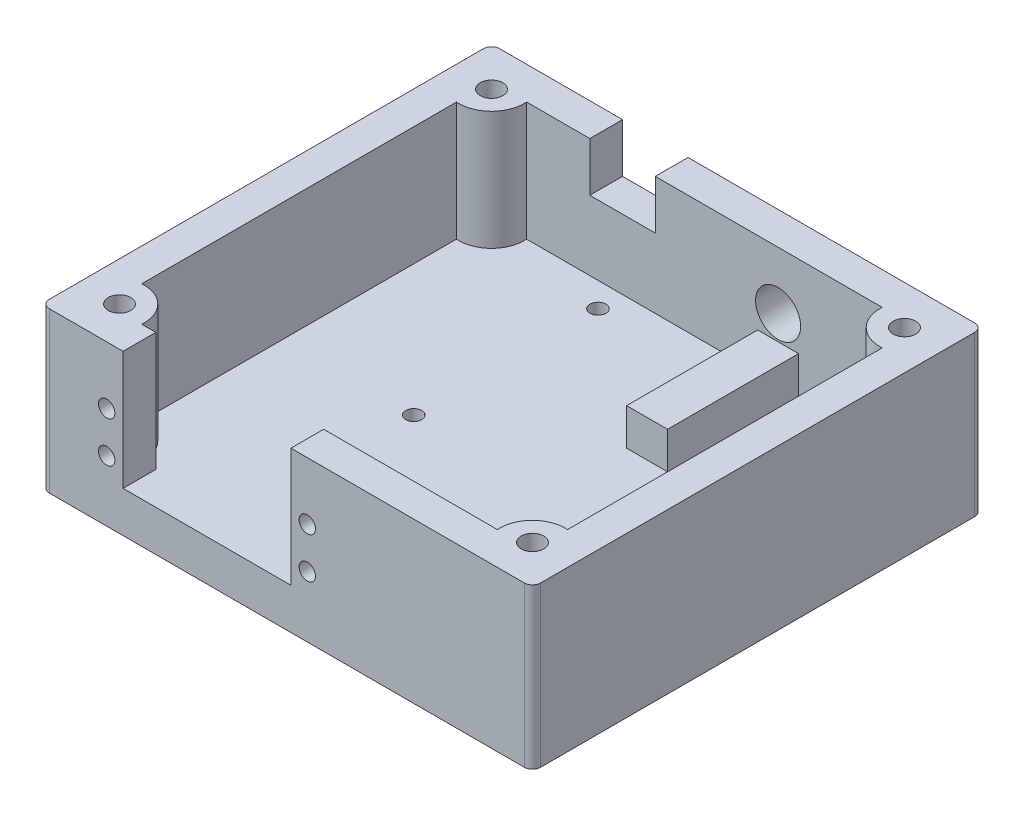
from build123d import *

# Parameters (mm, degrees)
SKETCH1_W           = 120
SKETCH1_H           = 110
BOSS_EXTRUDE1_DEPTH = 30
SKETCH2_W           = 104
SKETCH2_H           = 94
CUT_EXTRUDE1_DEPTH  = 26
FILLET1_R           = 2
CUT_EXTRUDE2_REACH  = 167.529
SKETCH3_W           = 41
SKETCH3_H           = 21
SKETCH5_R           = 2
CUT_EXTRUDE3_DEPTH  = 5
CUT_EXTRUDE4_REACH  = 167.529
SKETCH7_R           = 5.5
CUT_EXTRUDE5_REACH  = 167.529
SKETCH8_W           = 16
SKETCH8_H           = 9
SKETCH9_W           = 10
SKETCH9_H           = 32
BOSS_EXTRUDE2_DEPTH = 9
BOSS_EXTRUDE3_DEPTH = 26
BOSS_EXTRUDE4_DEPTH = 6
SKETCH11_R          = 1.95
CUT_EXTRUDE6_DEPTH  = 6
SKETCH13_R          = 2.75
CUT_EXTRUDE7_DEPTH  = 10
CUT_EXTRUDE8_REACH  = 167.529
SKETCH16_W          = 41
SKETCH16_H          = 5
BOSS_EXTRUDE5_START = 3
SKETCH21_R          = 2.75
BOSS_EXTRUDE5_DEPTH = 3


with BuildPart() as part:
    # Sketch1 → Boss-Extrude1 (new body)
    with BuildSketch(Plane(origin=(0, 0, 0), x_dir=(1, 0, 0), z_dir=(0, 1, 0))):
        with Locations((60, 55)):
            Rectangle(SKETCH1_W, SKETCH1_H)
    extrude(amount=BOSS_EXTRUDE1_DEPTH)

    # Sketch2 → Cut-Extrude1 (cut)
    with BuildSketch(Plane(origin=(0, 30, 0), x_dir=(1, 0, 0), z_dir=(0, 1, 0))):
        with Locations((60, 55)):
            Rectangle(SKETCH2_W, SKETCH2_H)
    extrude(amount=-CUT_EXTRUDE1_DEPTH, mode=Mode.SUBTRACT)

    # Fillet1
    fillet1_edges = [part.edges().sort_by_distance(p)[0] for p in [
        (112, 17, -8),
        (8, 17, -8),
        (8, 17, -102),
        (112, 17, -102),
        (0, 15, -110),
        (120, 15, -110),
        (120, 15, 0),
        (0, 15, 0),
    ]]
    fillet(fillet1_edges, radius=FILLET1_R)

    # Sketch3 → Cut-Extrude2 (cut, up to next)
    with BuildSketch(Plane.XY, mode=Mode.PRIVATE) as cut_extrude2_sk1:
        with Locations((40.5, 14.5)):
            Rectangle(SKETCH3_W, SKETCH3_H)
    cut_extrude2_tool1 = extrude(cut_extrude2_sk1.sketch, amount=-CUT_EXTRUDE2_REACH, mode=Mode.PRIVATE) & part.part
    add(cut_extrude2_tool1.solids().sort_by_distance((40.5, 14.5, 0))[0], mode=Mode.SUBTRACT)

    # Sketch5 → Cut-Extrude3 (cut)
    with BuildSketch(Plane.XY):
        with Locations((65, 8.9)):
            Circle(SKETCH5_R)
        with Locations((16, 18.9)):
            Circle(SKETCH5_R)
        with Locations((16, 8.9)):
            Circle(SKETCH5_R)
        with Locations((65, 18.9)):
            Circle(SKETCH5_R)
    extrude(amount=-CUT_EXTRUDE3_DEPTH, mode=Mode.SUBTRACT)

    # Sketch7 → Cut-Extrude4 (cut, up to next)
    with BuildSketch(Plane(origin=(0, 0, -110), x_dir=(-1, 0, 0), z_dir=(0, 0, -1)), mode=Mode.PRIVATE) as cut_extrude4_sk1:
        with Locations((-78, 19)):
            Circle(SKETCH7_R)
    cut_extrude4_tool1 = extrude(cut_extrude4_sk1.sketch, amount=-CUT_EXTRUDE4_REACH, mode=Mode.PRIVATE) & part.part
    add(cut_extrude4_tool1.solids().sort_by_distance((78, 19, -110))[0], mode=Mode.SUBTRACT)

    # Sketch8 → Cut-Extrude5 (cut, up to next)
    with BuildSketch(Plane(origin=(0, 0, -110), x_dir=(-1, 0, 0), z_dir=(0, 0, -1)), mode=Mode.PRIVATE) as cut_extrude5_sk1:
        with Locations((-40, 25.5)):
            Rectangle(SKETCH8_W, SKETCH8_H)
    cut_extrude5_tool1 = extrude(cut_extrude5_sk1.sketch, amount=-CUT_EXTRUDE5_REACH, mode=Mode.PRIVATE) & part.part
    add(cut_extrude5_tool1.solids().sort_by_distance((40, 25.5, -110))[0], mode=Mode.SUBTRACT)

    # Sketch9 → Boss-Extrude2 (add)
    with BuildSketch(Plane(origin=(0, 4, 0), x_dir=(1, 0, 0), z_dir=(0, 1, 0))):
        with Locations((78, 86)):
            Rectangle(SKETCH9_W, SKETCH9_H)
    extrude(amount=BOSS_EXTRUDE2_DEPTH)

    # Sketch10 → Boss-Extrude3 (add)
    with BuildSketch(Plane(origin=(0, 4, 0), x_dir=(1, 0, 0), z_dir=(0, 1, 0))):
        with BuildLine():
            ThreePointArc((10, 102), (8.585786438, 101.414213562), (8, 100))
            Line((8, 100), (8, 93.435688996))
            ThreePointArc((8, 93.435688996), (14.242640687, 95.757359313), (16.564311004, 102))
            Line((16.564311004, 102), (10, 102))
        make_face()
        with BuildLine():
            ThreePointArc((8, 10), (8.585786438, 8.585786438), (10, 8))
            Line((10, 8), (16.564311004, 8))
            ThreePointArc((16.564311004, 8), (14.242640687, 14.242640687), (8, 16.564311004))
            Line((8, 16.564311004), (8, 10))
        make_face()
        with BuildLine():
            ThreePointArc((110, 8), (111.414213562, 8.585786438), (112, 10))
            Line((112, 10), (112, 16.564311004))
            ThreePointArc((112, 16.564311004), (105.757359313, 14.242640687), (103.435688996, 8))
            Line((103.435688996, 8), (110, 8))
        make_face()
        with BuildLine():
            ThreePointArc((112, 100), (111.414213562, 101.414213562), (110, 102))
            Line((110, 102), (103.435688996, 102))
            ThreePointArc((103.435688996, 102), (105.757359313, 95.757359313), (112, 93.435688996))
            Line((112, 93.435688996), (112, 100))
        make_face()
    extrude(amount=BOSS_EXTRUDE3_DEPTH)

    # Sketch12 → Boss-Extrude4 (add)
    with BuildSketch(Plane.XZ):
        with BuildLine():
            Line((2, -110), (118, -110))
            ThreePointArc((118, -110), (119.414213562, -109.414213562), (120, -108))
            Line((120, -108), (120, -2))
            ThreePointArc((120, -2), (119.414213562, -0.585786438), (118, 0))
            Line((118, 0), (2, 0))
            ThreePointArc((2, 0), (0.585786438, -0.585786438), (0, -2))
            Line((0, -2), (0, -108))
            ThreePointArc((0, -108), (0.585786438, -109.414213562), (2, -110))
        make_face()
    extrude(amount=BOSS_EXTRUDE4_DEPTH)

    # Sketch11 → Cut-Extrude6 (cut)
    with BuildSketch(Plane(origin=(0, 4, 0), x_dir=(1, 0, 0), z_dir=(0, 1, 0))):
        with Locations(Location((40, 96, 0), (0, 0, 270))):
            Circle(SKETCH11_R)
        with Locations(Location((40, 51, 0), (0, 0, 270))):
            Circle(SKETCH11_R)
        with Locations(Location((88.5, 80, 0), (0, 0, 270))):
            Circle(SKETCH11_R)
        with Locations(Location((107.5, 80, 0), (0, 0, 270))):
            Circle(SKETCH11_R)
        with Locations(Location((88.5, 24, 0), (0, 0, 270))):
            Circle(SKETCH11_R)
        with Locations(Location((107.5, 24, 0), (0, 0, 270))):
            Circle(SKETCH11_R)
    extrude(amount=-CUT_EXTRUDE6_DEPTH, mode=Mode.SUBTRACT)

    # Sketch13 → Cut-Extrude7 (cut)
    with BuildSketch(Plane(origin=(0, 30, 0), x_dir=(1, 0, 0), z_dir=(0, 1, 0))):
        with Locations(Location((110.435688996, 100.435688996, 0), (0, 0, 90))):
            Circle(SKETCH13_R)
        with Locations(Location((9.564311004, 100.435688996, 0), (0, 0, 270))):
            Circle(SKETCH13_R)
        with Locations(Location((110.435688996, 9.564311004, 0), (0, 0, 270))):
            Circle(SKETCH13_R)
        with Locations(Location((9.564311004, 9.564311004, 0), (0, 0, 90))):
            Circle(SKETCH13_R)
    extrude(amount=-CUT_EXTRUDE7_DEPTH, mode=Mode.SUBTRACT)

    # Sketch16 → Cut-Extrude8 (cut, up to next)
    with BuildSketch(Plane.XY, mode=Mode.PRIVATE) as cut_extrude8_sk1:
        with Locations((40.5, 27.5)):
            Rectangle(SKETCH16_W, SKETCH16_H)
    cut_extrude8_tool1 = extrude(cut_extrude8_sk1.sketch, amount=-CUT_EXTRUDE8_REACH, mode=Mode.PRIVATE) & part.part
    add(cut_extrude8_tool1.solids().sort_by_distance((40.5, 27.5, 0))[0], mode=Mode.SUBTRACT)

    # Sketch21 → Boss-Extrude5 (add)
    # profile 1 of 2: a face of its own
    with BuildSketch(Plane(origin=(0, 30, 0), x_dir=(1, 0, 0), z_dir=(0, 1, 0)).offset(BOSS_EXTRUDE5_START)):
        with BuildLine():
            ThreePointArc((112, 16.564311004), (105.757359313, 14.242640687), (103.435688996, 8))
            Line((103.435688996, 8), (61, 8))
            Line((61, 8), (61, 0))
            Line((61, 0), (118, 0))
            ThreePointArc((118, 0), (119.414213562, 0.585786438), (120, 2))
            Line((120, 2), (120, 108))
            ThreePointArc((120, 108), (119.414213562, 109.414213562), (118, 110))
            Line((118, 110), (48, 110))
            Line((48, 110), (48, 102))
            Line((48, 102), (103.435688996, 102))
            ThreePointArc((103.435688996, 102), (105.757359313, 95.757359313), (112, 93.435688996))
            Line((112, 93.435688996), (112, 16.564311004))
        make_face()
        with Locations((110.435688996, 9.564311004)):
            Circle(SKETCH21_R, mode=Mode.SUBTRACT)
        with Locations((110.435688996, 100.435688996)):
            Circle(SKETCH21_R, mode=Mode.SUBTRACT)
    # profile 2 of 2: a face of its own
    with BuildSketch(Plane(origin=(0, 30, 0), x_dir=(1, 0, 0), z_dir=(0, 1, 0)).offset(BOSS_EXTRUDE5_START)):
        with BuildLine():
            Line((8, 16.564311004), (8, 93.435688996))
            ThreePointArc((8, 93.435688996), (14.242640687, 95.757359313), (16.564311004, 102))
            Line((16.564311004, 102), (32, 102))
            Line((32, 102), (32, 110))
            Line((32, 110), (2, 110))
            ThreePointArc((2, 110), (0.585786438, 109.414213562), (0, 108))
            Line((0, 108), (0, 2))
            ThreePointArc((0, 2), (0.585786438, 0.585786438), (2, 0))
            Line((2, 0), (20, 0))
            Line((20, 0), (20, 8))
            Line((20, 8), (16.564311004, 8))
            ThreePointArc((16.564311004, 8), (14.242640687, 14.242640687), (8, 16.564311004))
        make_face()
        with Locations((9.564311004, 9.564311004)):
            Circle(SKETCH21_R, mode=Mode.SUBTRACT)
        with Locations((9.564311004, 100.435688996)):
            Circle(SKETCH21_R, mode=Mode.SUBTRACT)
    extrude(amount=-BOSS_EXTRUDE5_DEPTH)


solid = part.part
